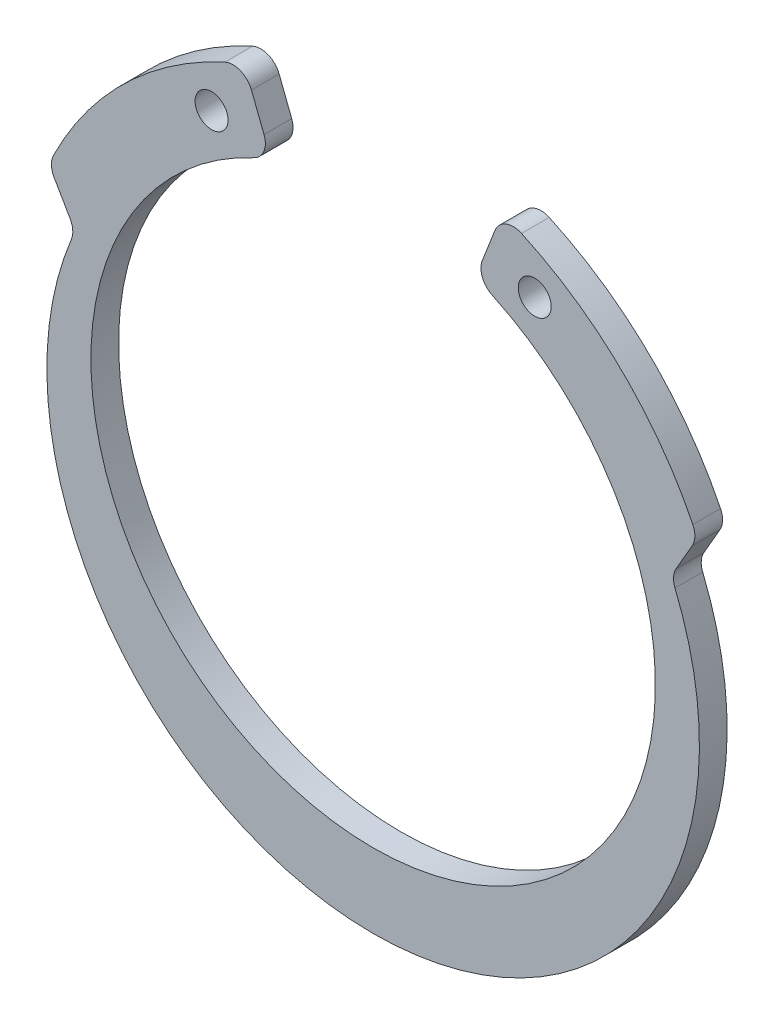
from build123d import *

# Parameters (mm, degrees)
SKETCH1_R           = 0.635
BOSS_EXTRUDE1_DEPTH = 0.5334
FILLET1_R           = 0.762


with BuildPart() as part:
    # Sketch1 → Boss-Extrude1 (new, symmetric)
    with BuildSketch(Plane.XY):
        with BuildLine():
            Line((0, -10.8712), (0, -13.7287))
            ThreePointArc((0, -13.7287), (10.539853689, -8.005916567), (11.480547007, 3.950414898))
            Line((11.480547007, 3.950414898), (12.490007611, 5.698851952))
            ThreePointArc((12.490007611, 5.698851952), (9.424661953, 9.982632457), (4.97184229, 12.796796003))
            Line((4.97184229, 12.796796003), (3.937, 10.13326307))
            ThreePointArc((3.937, 10.13326307), (10.685123278, -2.002780562), (0, -10.8712))
        make_face()
        with Locations((6.223, 10.609573083)):
            Circle(SKETCH1_R, mode=Mode.SUBTRACT)
    extrude(amount=BOSS_EXTRUDE1_DEPTH, both=True)

    # Fillet1
    fillet1_edges = [part.edges().sort_by_distance(p)[0] for p in [
        (12.490007611, 5.698851952, 0),
        (11.480547007, 3.950414898, 0),
        (3.937, 10.13326307, 0),
        (4.97184229, 12.796796003, 0),
    ]]
    fillet(fillet1_edges, radius=FILLET1_R)

    # Mirror1: part across plane


with BuildPart() as part_1:
    add(part.part)
    add(part.part.mirror(Plane(origin=(0, 0, 0), x_dir=(0, 0, 1), z_dir=(1, 0, 0))))


solid = part_1.part
